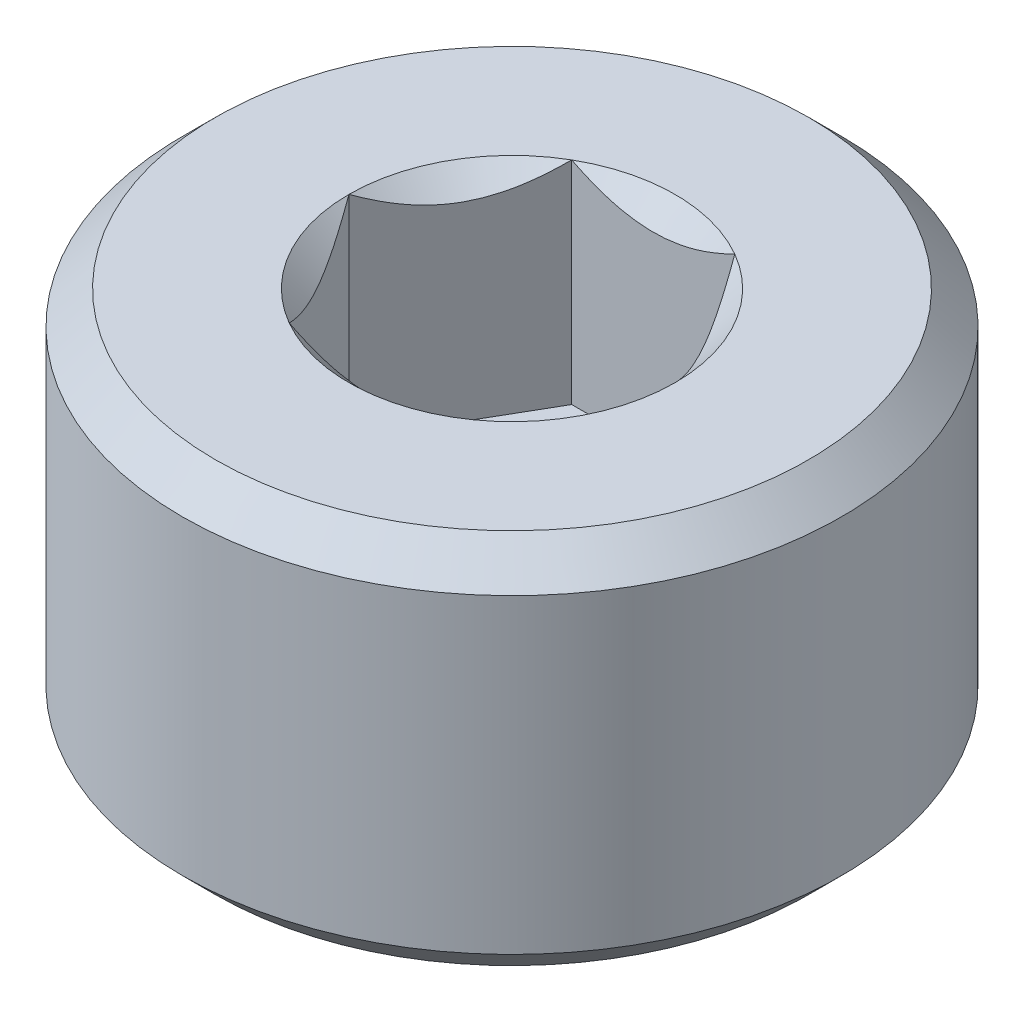
from build123d import *

# Parameters (mm, degrees)
SKETCH1_R           = 3.5
BOSS_EXTRUDE1_DEPTH = 4
CUT_EXTRUDE1_DEPTH  = 2.25
CHAMFER1_SIZE       = 0.35


with BuildPart() as part:
    # Sketch1 → Boss-Extrude1 (new body)
    with BuildSketch(Plane(origin=(0, 0, 0), x_dir=(1, 0, 0), z_dir=(0, 1, 0))):
        with Locations(Location((0, 0, 0), (0, 0, 270))):
            Circle(SKETCH1_R)
    extrude(amount=BOSS_EXTRUDE1_DEPTH)

    # Sketch2 → Cut-Extrude1 (cut)
    with BuildSketch(Plane(origin=(0, 4, 0), x_dir=(1, 0, 0), z_dir=(0, 1, 0))):
        Polygon((0.866025404, 1.5), (-0.866025404, 1.5), (-1.732050808, 0), (-0.866025404, -1.5), (0.866025404, -1.5), (1.732050808, 0), align=None)
    extrude(amount=-CUT_EXTRUDE1_DEPTH, mode=Mode.SUBTRACT)

    # Cut-Extrude2 cone 1 section (through the dimple's axis) → Cut-Extrude2 (revolve, cut)
    with BuildSketch(Plane(origin=(0, 4, 0), x_dir=(0, 0, 1), z_dir=(1, 0, 0))):
        Polygon((0, 0), (1.732050808, 0), (0, 1.732050808), align=None)
    revolve(axis=Axis((0, 4, 0), (0, -1, 0)), mode=Mode.SUBTRACT)

    # Chamfer1
    chamfer1_edges = [part.edges().sort_by_distance(p)[0] for p in [
        (0, 0, -3.5),
        (0, 4, -3.5),
    ]]
    chamfer(chamfer1_edges, length=CHAMFER1_SIZE)


solid = part.part
